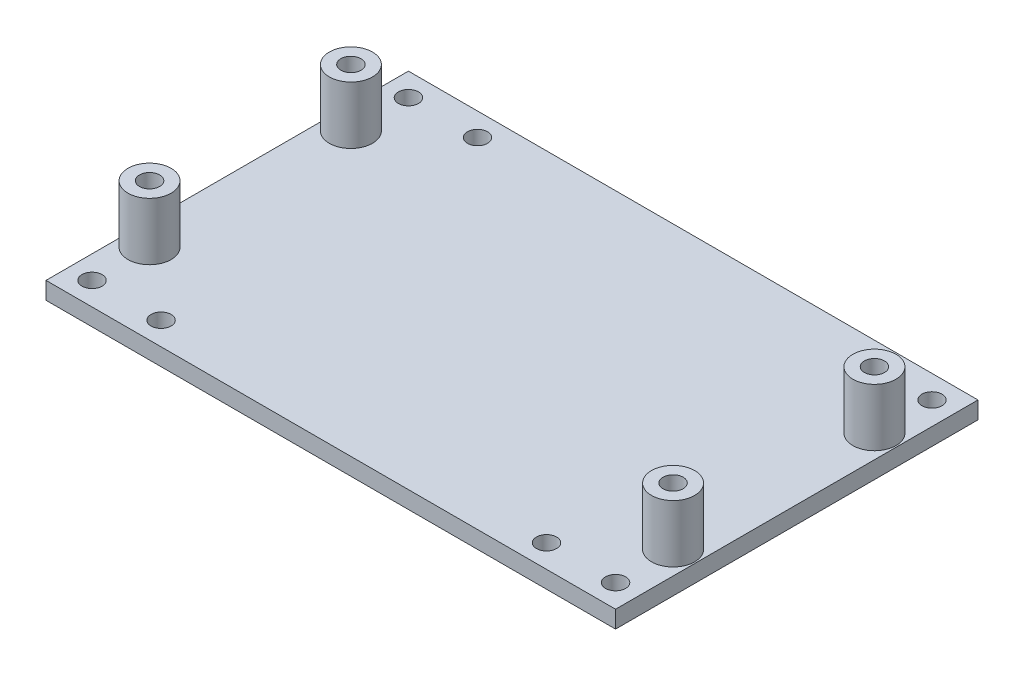
from build123d import *

# Parameters (mm, degrees)
SKETCH1_W           = 99
SKETCH1_H           = 63
SKETCH1_R           = 3.75
SKETCH1_R_2         = 1.75
BOSS_EXTRUDE1_DEPTH = 3
SKETCH1_3_R         = 3.75
SKETCH1_3_R_2       = 1.75
BOSS_EXTRUDE2_DEPTH = 13


with BuildPart() as part:
    # Sketch1 → Boss-Extrude1 (new body)
    with BuildSketch(Plane(origin=(0, 0, 0), x_dir=(1, 0, 0), z_dir=(0, 1, 0))):
        Rectangle(SKETCH1_W, SKETCH1_H)
        with Locations((-45.5, -17.5)):
            Circle(SKETCH1_R, mode=Mode.SUBTRACT)
        with Locations((45.5, -17.5)):
            Circle(SKETCH1_R, mode=Mode.SUBTRACT)
        with Locations((-45.5, 17.5)):
            Circle(SKETCH1_R, mode=Mode.SUBTRACT)
        with Locations((45.5, 17.5)):
            Circle(SKETCH1_R, mode=Mode.SUBTRACT)
        with Locations((45.5, 27.5)):
            Circle(SKETCH1_R_2, mode=Mode.SUBTRACT)
        with Locations((-45.5, 27.5)):
            Circle(SKETCH1_R_2, mode=Mode.SUBTRACT)
        with Locations((-33.5, 27.5)):
            Circle(SKETCH1_R_2, mode=Mode.SUBTRACT)
        with Locations((33.5, 27.5)):
            Circle(SKETCH1_R_2, mode=Mode.SUBTRACT)
        with Locations((45.5, -27.5)):
            Circle(SKETCH1_R_2, mode=Mode.SUBTRACT)
        with Locations((-45.5, -27.5)):
            Circle(SKETCH1_R_2, mode=Mode.SUBTRACT)
        with Locations((-33.5, -27.5)):
            Circle(SKETCH1_R_2, mode=Mode.SUBTRACT)
        with Locations((33.5, -27.5)):
            Circle(SKETCH1_R_2, mode=Mode.SUBTRACT)
    extrude(amount=BOSS_EXTRUDE1_DEPTH)

    # Sketch1<3> → Boss-Extrude2 (add)
    # profile 1 of 4: a face of its own
    with BuildSketch(Plane(origin=(0, 0, 0), x_dir=(1, 0, 0), z_dir=(0, 1, 0))):
        with Locations((-45.5, 17.5)):
            Circle(SKETCH1_3_R)
        with Locations((-45.5, 17.5)):
            Circle(SKETCH1_3_R_2, mode=Mode.SUBTRACT)
    # profile 2 of 4: a face of its own
    with BuildSketch(Plane(origin=(0, 0, 0), x_dir=(1, 0, 0), z_dir=(0, 1, 0))):
        with Locations((-45.5, -17.5)):
            Circle(SKETCH1_3_R)
        with Locations((-45.5, -17.5)):
            Circle(SKETCH1_3_R_2, mode=Mode.SUBTRACT)
    # profile 3 of 4: a face of its own
    with BuildSketch(Plane(origin=(0, 0, 0), x_dir=(1, 0, 0), z_dir=(0, 1, 0))):
        with Locations((45.5, -17.5)):
            Circle(SKETCH1_3_R)
        with Locations((45.5, -17.5)):
            Circle(SKETCH1_3_R_2, mode=Mode.SUBTRACT)
    # profile 4 of 4: a face of its own
    with BuildSketch(Plane(origin=(0, 0, 0), x_dir=(1, 0, 0), z_dir=(0, 1, 0))):
        with Locations((45.5, 17.5)):
            Circle(SKETCH1_3_R)
        with Locations((45.5, 17.5)):
            Circle(SKETCH1_3_R_2, mode=Mode.SUBTRACT)
    extrude(amount=BOSS_EXTRUDE2_DEPTH)


solid = part.part
